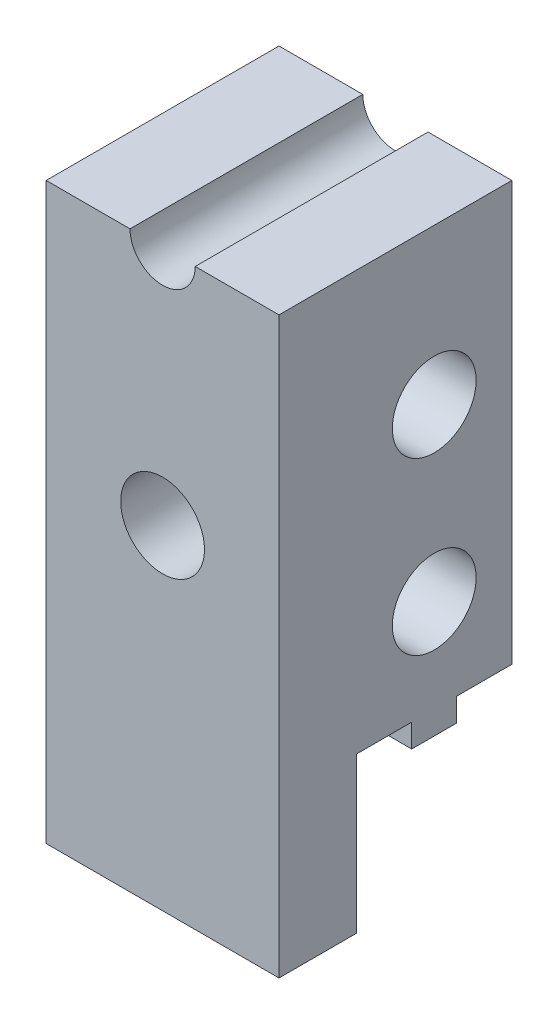
from build123d import *

# Parameters (mm, degrees)
SKETCH24_R          = 5.4
BOSS_EXTRUDE1_DEPTH = 30
SKETCH26_R          = 4.2
RODS_SLOT_DEPTH     = 62.731822261
SKETCH25_R          = 5.4
RODS_HOLE_DEPTH     = 50


with BuildPart() as part:
    # Sketch24 → Boss-Extrude1 (new body)
    with BuildSketch(Plane(origin=(0, 0, 0), x_dir=(0, 0, -1), z_dir=(1, 0, 0))):
        Polygon((10, -9.157855987), (10, 44.842144013), (-20, 44.842144013), (-20, -29.157855987), (-10, -29.157855987), (-10, -9.157855987), (-2.9, -9.157855987), (-2.9, -12.157855987), (2.9, -12.157855987), (2.9, -9.157855987), align=None)
        with Locations((0, 24.842144013)):
            Circle(SKETCH24_R, mode=Mode.SUBTRACT)
        with Locations((0, 2.842144013)):
            Circle(SKETCH24_R, mode=Mode.SUBTRACT)
    extrude(amount=BOSS_EXTRUDE1_DEPTH)

    # Sketch26 → rods_slot (cut, through all)
    with BuildSketch(Plane.XY.offset(-10)):
        with Locations((15, 44.842144013)):
            Circle(SKETCH26_R)
    extrude(amount=RODS_SLOT_DEPTH, mode=Mode.SUBTRACT)

    # Sketch25 → rods-hole (cut)
    with BuildSketch(Plane.XY.offset(20)):
        with Locations((15, 13.842144013)):
            Circle(SKETCH25_R)
    extrude(amount=-RODS_HOLE_DEPTH, mode=Mode.SUBTRACT)


solid = part.part
